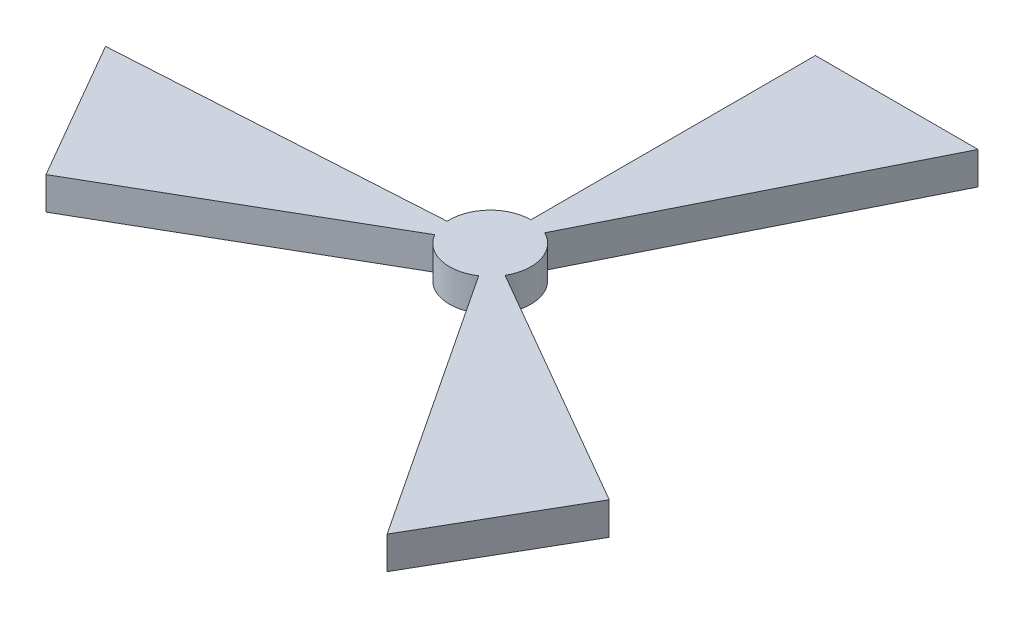
from build123d import *

# Parameters (mm, degrees)
SKETCH1_R           = 12.5
BOSS_EXTRUDE1_DEPTH = 10


with BuildPart() as part:
    # Sketch1 → Boss-Extrude1 (new body)
    with BuildSketch(Plane(origin=(0, 0, 0), x_dir=(1, 0, 0), z_dir=(0, 1, 0))):
        Circle(SKETCH1_R)
        Polygon((50, 100), (0, 0), (0, 100), align=None)
        Polygon((-111.602540378, -6.698729811), (0, 0), (-86.602540378, -50), align=None)
        Polygon((61.602540378, -93.301270189), (0, 0), (86.602540378, -50), align=None)
        with BuildLine():
            Line((-12.477543337, -0.748940761), (0, 0))
            Line((0, 0), (0, 12.5))
            ThreePointArc((0, 12.5), (-9.09977361, 8.569954507), (-12.477543337, -0.748940761))
        make_face()
        with BuildLine():
            Line((0, 12.5), (0, 0))
            Line((0, 0), (5.590169944, 11.180339887))
            ThreePointArc((5.590169944, 11.180339887), (2.871911507, 12.165612368), (0, 12.5))
        make_face()
        with BuildLine():
            Line((5.590169944, 11.180339887), (0, 0))
            Line((0, 0), (10.825317547, -6.25))
            ThreePointArc((10.825317547, -6.25), (12.074072829, -3.235238064), (12.5, 0))
            ThreePointArc((12.5, 0), (10.633135104, 6.571638901), (5.590169944, 11.180339887))
        make_face()
        with BuildLine():
            Line((10.825317547, -6.25), (0, 0))
            Line((0, 0), (6.887373394, -10.431399127))
            ThreePointArc((6.887373394, -10.431399127), (9.09977361, -8.569954507), (10.825317547, -6.25))
        make_face()
        with BuildLine():
            Line((6.887373394, -10.431399127), (0, 0))
            Line((0, 0), (-10.825317547, -6.25))
            ThreePointArc((-10.825317547, -6.25), (-2.871911507, -12.165612368), (6.887373394, -10.431399127))
        make_face()
        with BuildLine():
            Line((-10.825317547, -6.25), (0, 0))
            Line((0, 0), (-12.477543337, -0.748940761))
            ThreePointArc((-12.477543337, -0.748940761), (-11.971685117, -3.595657862), (-10.825317547, -6.25))
        make_face()
    extrude(amount=BOSS_EXTRUDE1_DEPTH)


solid = part.part
